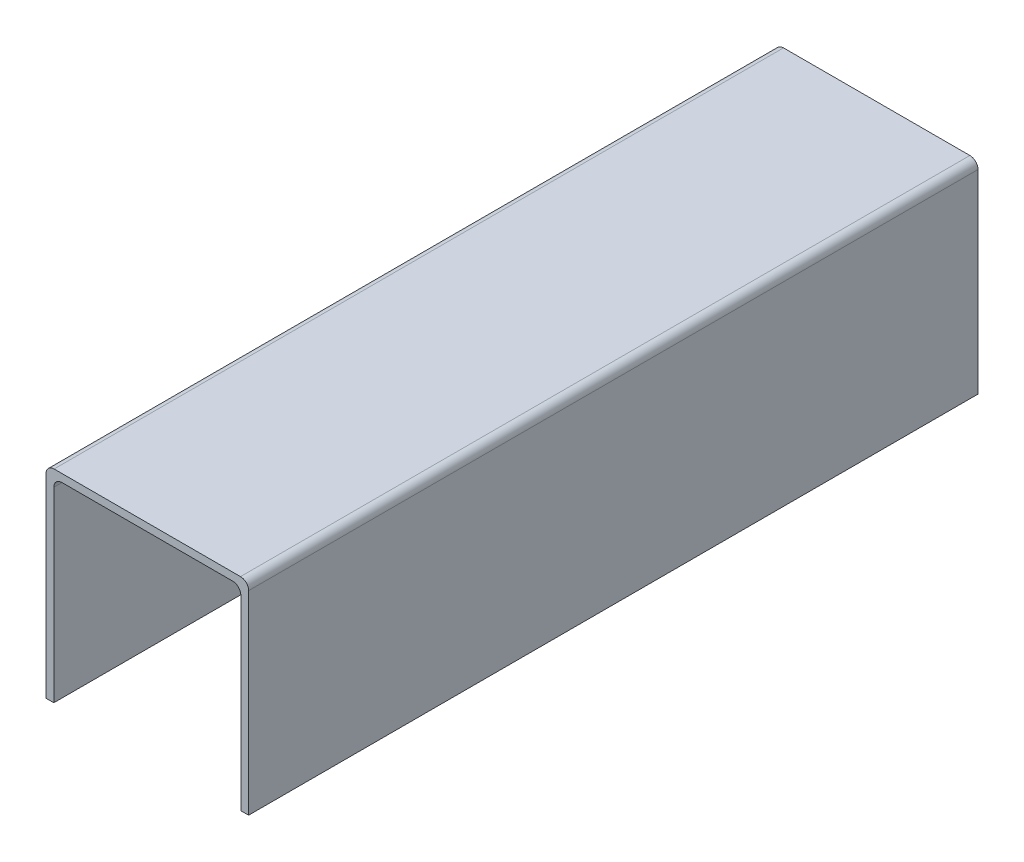
from build123d import *

# Parameters (mm, degrees)
BOSS_EXTRUDE1_DEPTH = 180
FILLET1_R           = 2


with BuildPart() as part:
    # Sketch1 → Boss-Extrude1 (new body)
    with BuildSketch(Plane.XY):
        Polygon((0, 0), (0, 50), (50, 50), (50, 0), (48.07222, 0), (48.07222, 48.07222), (1.92778, 48.07222), (1.92778, 0), align=None)
    extrude(amount=BOSS_EXTRUDE1_DEPTH)

    # Fillet1
    fillet1_edges = [part.edges().sort_by_distance(p)[0] for p in [
        (0, 50, 90),
        (50, 50, 90),
        (48.07222, 48.07222, 90),
        (1.92778, 48.07222, 90),
    ]]
    fillet(fillet1_edges, radius=FILLET1_R)


solid = part.part
